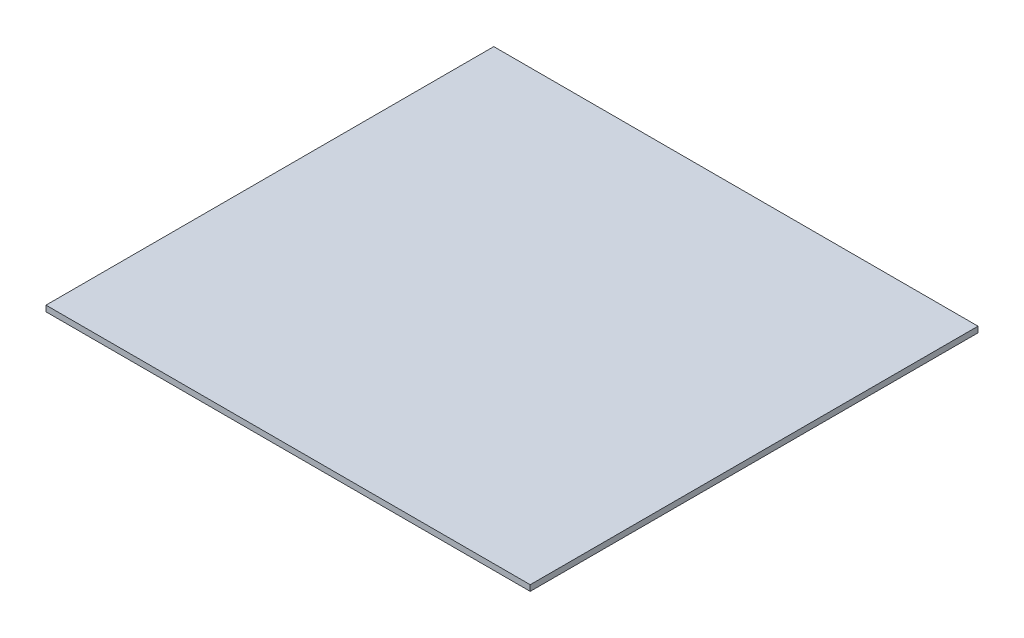
from build123d import *

# Parameters (mm, degrees)
SKETCH1_W           = 124.9
SKETCH1_H           = 115.5
BOSS_EXTRUDE1_DEPTH = 1.5


with BuildPart() as part:
    # Sketch1 → Boss-Extrude1 (new body)
    with BuildSketch(Plane(origin=(0, 0, 0), x_dir=(1, 0, 0), z_dir=(0, 1, 0))):
        Rectangle(SKETCH1_W, SKETCH1_H)
    extrude(amount=BOSS_EXTRUDE1_DEPTH)


solid = part.part
